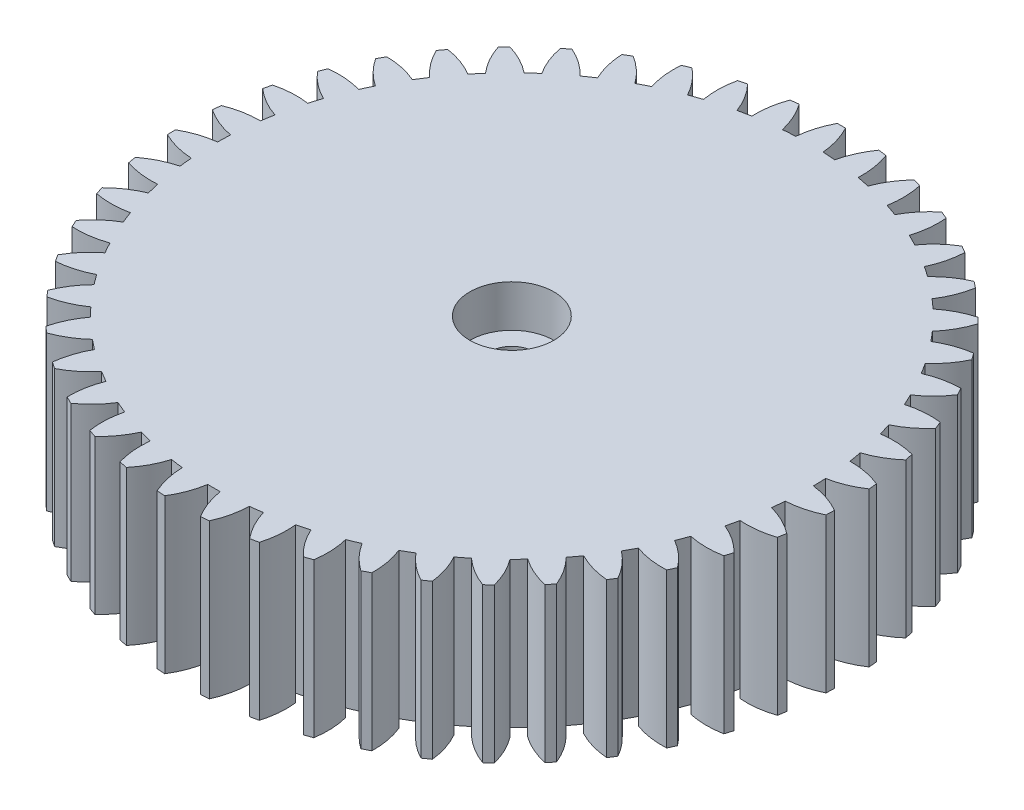
from build123d import *

# Parameters (mm, degrees)
SKETCH1_R           = 21.25
BOSS_EXTRUDE1_DEPTH = 10.4
SKETCH8_R           = 2.825
CUT_EXTRUDE3_DEPTH  = 3.7
BOSS_EXTRUDE3_START = -11
BOSS_EXTRUDE3_DEPTH = 11
CIRPATTERN1_COUNT   = 47
SKETCH10_R          = 1.6
CUT_EXTRUDE4_DEPTH  = 10
SKETCH11_R          = 3
CUT_EXTRUDE5_DEPTH  = 3


with BuildPart() as part:
    # Sketch1 → Boss-Extrude1 (new body)
    with BuildSketch(Plane(origin=(0, 0, 0), x_dir=(1, 0, 0), z_dir=(0, 1, 0))):
        with Locations(Location((0, 0, 0), (0, 0, 270))):
            Circle(SKETCH1_R)
    extrude(amount=BOSS_EXTRUDE1_DEPTH)

    # Sketch8 → Cut-Extrude3 (cut)
    with BuildSketch(Plane(origin=(0, 0, 0), x_dir=(-1, 0, 0), z_dir=(0, -1, 0))):
        with Locations(Location((0, 0, 0), (0, 0, 90))):
            Circle(SKETCH8_R)
    extrude(amount=-CUT_EXTRUDE3_DEPTH, mode=Mode.SUBTRACT)

    # Sketch9 → Boss-Extrude3 (add)
    with BuildSketch(Plane(origin=(0, 10.4, 0), x_dir=(1, 0, 0), z_dir=(0, 1, 0)).offset(BOSS_EXTRUDE3_START)):
        with BuildLine():
            ThreePointArc((-0.292653692, 23.510495066), (-0.746983902, 22.403188952), (-0.972488982, 21.22773575))
            ThreePointArc((-0.972488982, 21.22773575), (0, 21.249999997), (0.972488982, 21.22773575))
            ThreePointArc((0.972488982, 21.22773575), (0.746983902, 22.403188952), (0.292653692, 23.510495066))
            ThreePointArc((0.292653692, 23.510495066), (0, 23.512316441), (-0.292653692, 23.510495066))
        make_face()
    boss_extrude3 = extrude(amount=BOSS_EXTRUDE3_DEPTH)

    # CirPattern1: Boss-Extrude3 ×47 about axis
    cirpattern1_axis = Axis((0, 0, 0), (0, 1, 0))
    for i in range(1, CIRPATTERN1_COUNT):
        add(boss_extrude3.rotate(cirpattern1_axis, i * 360 / CIRPATTERN1_COUNT))

    # Sketch10 → Cut-Extrude4 (cut)
    with BuildSketch(Plane(origin=(0, 10.4, 0), x_dir=(1, 0, 0), z_dir=(0, 1, 0))):
        with Locations(Location((0, 0, 0), (0, 0, 270))):
            Circle(SKETCH10_R)
    extrude(amount=-CUT_EXTRUDE4_DEPTH, mode=Mode.SUBTRACT)

    # Sketch11 → Cut-Extrude5 (cut)
    with BuildSketch(Plane(origin=(0, 10.4, 0), x_dir=(1, 0, 0), z_dir=(0, 1, 0))):
        with Locations(Location((0, 0, 0), (0, 0, 270))):
            Circle(SKETCH11_R)
    extrude(amount=-CUT_EXTRUDE5_DEPTH, mode=Mode.SUBTRACT)


solid = part.part
